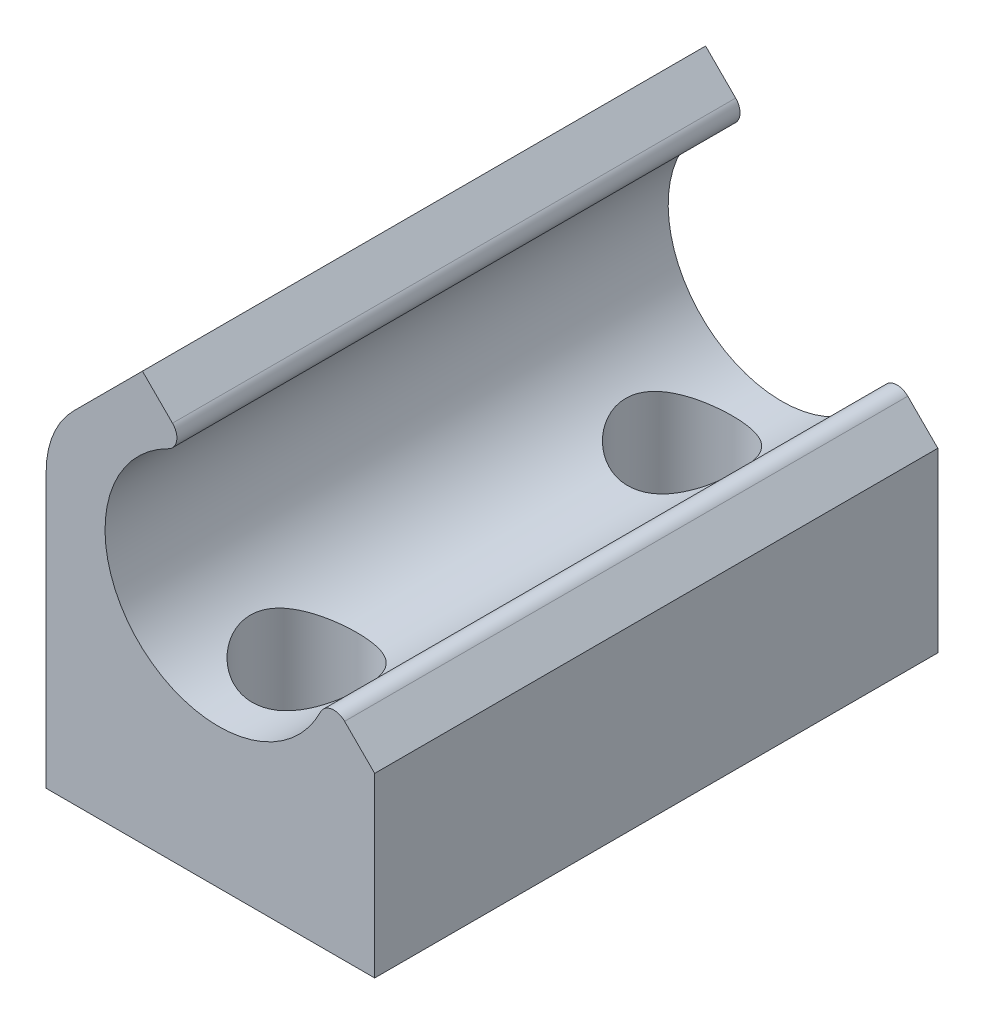
from build123d import *

# Parameters (mm, degrees)
BOSS_EXTRUDE1_DEPTH = 30
FILLET1_R           = 0.8
SKETCH3_R           = 3
CUT_EXTRUDE1_DEPTH  = 9
SKETCH4_R           = 1.55
CUT_EXTRUDE2_DEPTH  = 37.426390381
FILLET2_R           = 5


with BuildPart() as part:
    # Sketch1 → Boss-Extrude1 (new body)
    with BuildSketch(Plane.XY):
        with BuildLine():
            Line((0, 0), (17.5, 0))
            Line((17.5, 0), (17.5, 9.44))
            Line((17.5, 9.44), (15.025126266, 11.914873734))
            ThreePointArc((15.025126266, 11.914873734), (4.907782078, 9.219443047), (7.603212766, 19.336787234))
            Line((7.603212766, 19.336787234), (5.128339032, 21.811660968))
            Line((5.128339032, 21.811660968), (0, 16.683321936))
            Line((0, 16.683321936), (0, 0))
        make_face()
    extrude(amount=BOSS_EXTRUDE1_DEPTH)

    # Fillet1
    fillet1_edges = [part.edges().sort_by_distance(p)[0] for p in [
        (7.603212766, 19.336787234, 15),
        (15.025126266, 11.914873734, 15),
    ]]
    fillet(fillet1_edges, radius=FILLET1_R)

    # Sketch3 → Cut-Extrude1 (cut)
    with BuildSketch(Plane(origin=(0, 10.828405067, 0), x_dir=(-1, 0, 0), z_dir=(0, -1, 0))):
        with Locations(Location((-8.875495285, -5, 0), (0, 0, 270))):
            Circle(SKETCH3_R)
        with Locations(Location((-8.875495285, -25, 0), (0, 0, 270))):
            Circle(SKETCH3_R)
    extrude(amount=CUT_EXTRUDE1_DEPTH, mode=Mode.SUBTRACT)

    # Sketch4 → Cut-Extrude2 (cut, through all)
    with BuildSketch(Plane(origin=(0, 10.828405067, 0), x_dir=(-1, 0, 0), z_dir=(0, -1, 0))):
        with Locations(Location((-8.875495285, -5, 0), (0, 0, 90))):
            Circle(SKETCH4_R)
        with Locations(Location((-8.875495285, -25, 0), (0, 0, 90))):
            Circle(SKETCH4_R)
    extrude(amount=CUT_EXTRUDE2_DEPTH, mode=Mode.SUBTRACT)

    # Fillet2
    fillet2_edges = [part.edges().sort_by_distance(p)[0] for p in [
        (0, 16.683321936, 15),
    ]]
    fillet(fillet2_edges, radius=FILLET2_R)


solid = part.part
